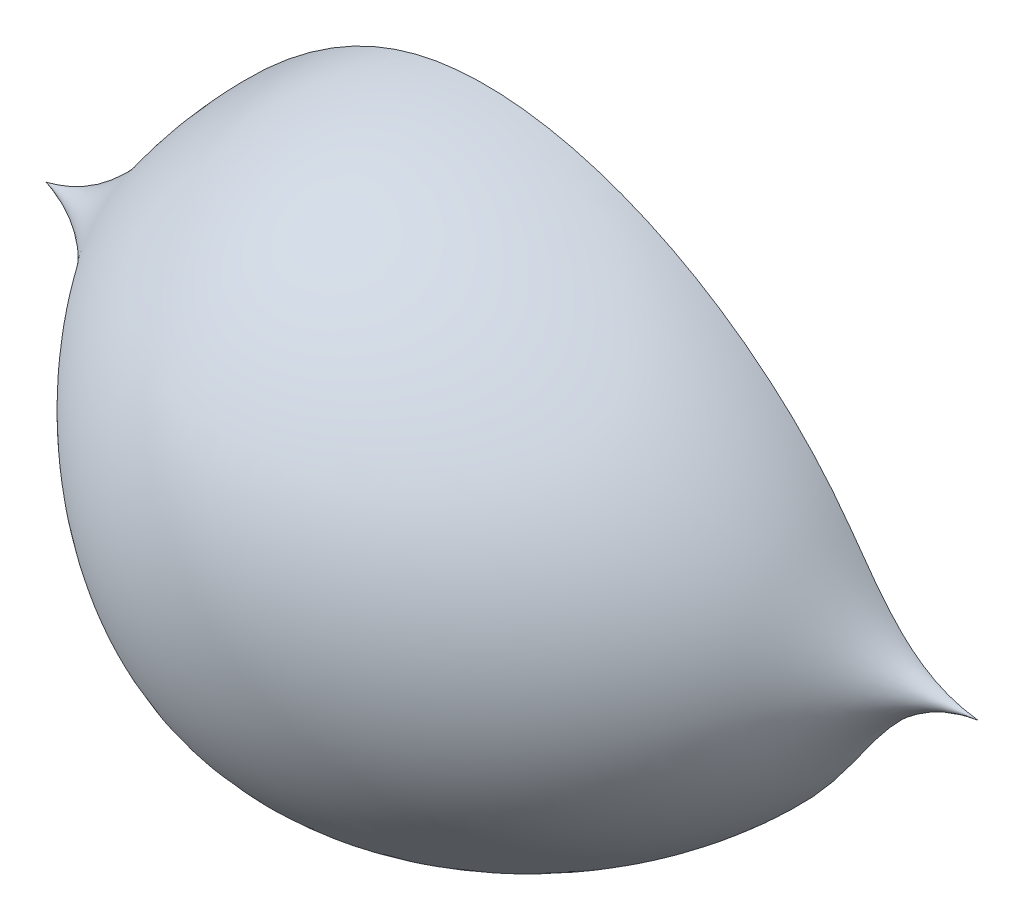
from build123d import *

# Parameters (mm, degrees)
REVOLVE3_ANGLE = 180


with BuildPart() as part:
    # Sketch1 → Revolve3 (revolve)
    with BuildSketch(Plane.XY):
        with BuildLine():
            Line((-672.678665165, -72.465267442), (-204.433639486, -72.465267442))
            add(Edge.make_bspline(
                [(-672.678665165, -72.465267442), (-638.799908049, -63.623415226), (-596.022054302, 3.801565536), (-472.235753413, 121.492503949), (-287.429212036, 33.95772962), (-240.980324753, -68.145751286), (-204.433639486, -72.465267442)],
                knots=[0, 0, 0, 0, 0.173485695, 0.419711635, 0.829962471, 1, 1, 1, 1], degree=3))
        make_face()
    revolve(axis=Axis((-672.678665165, -72.465267442, 0), (1, 0, 0)), revolution_arc=REVOLVE3_ANGLE)


solid = part.part
